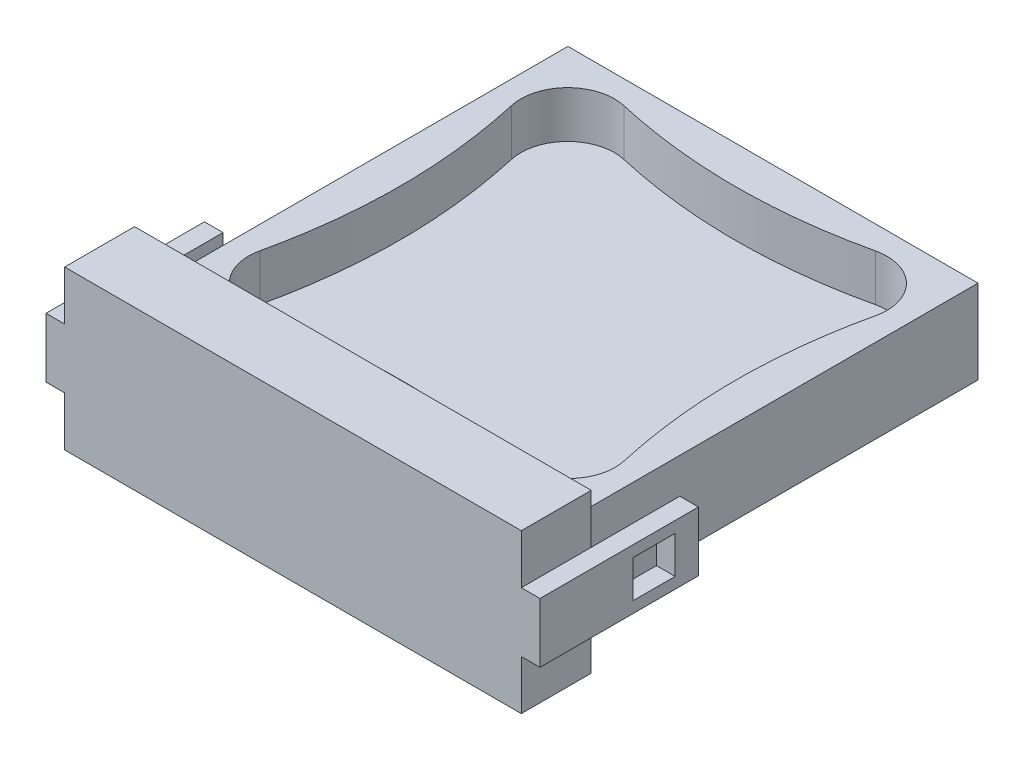
from build123d import *

# Parameters (mm, degrees)
SKETCH1_W           = 44
SKETCH1_H           = 44
BOSS_EXTRUDE1_DEPTH = 9
SKETCH2_W           = 49
SKETCH2_H           = 17
BOSS_EXTRUDE2_DEPTH = 7.5
CUT_EXTRUDE1_DEPTH  = 5
SKETCH4_W           = 4.5
SKETCH4_H           = 4
BOSS_EXTRUDE3_DEPTH = 2


with BuildPart() as part:
    # Sketch1 → Boss-Extrude1 (new body)
    with BuildSketch(Plane(origin=(0, 0, 0), x_dir=(1, 0, 0), z_dir=(0, 1, 0))):
        Rectangle(SKETCH1_W, SKETCH1_H)
    extrude(amount=BOSS_EXTRUDE1_DEPTH)

    # Sketch2 → Boss-Extrude2 (add)
    with BuildSketch(Plane.XY.offset(22)):
        with Locations((0, 4.5)):
            Rectangle(SKETCH2_W, SKETCH2_H)
    extrude(amount=BOSS_EXTRUDE2_DEPTH)

    # Sketch3 → Cut-Extrude1 (cut)
    with BuildSketch(Plane(origin=(0, 9, 0), x_dir=(1, 0, 0), z_dir=(0, 1, 0))):
        with BuildLine():
            ThreePointArc((-19.5325, -13.495), (-18.170661955, -18.166166123), (-13.49, -19.495))
            add(Edge.make_bspline(
                [(-13.49, -19.495), (-4.496666667, -17.441666667), (4.496666667, -17.441666667), (13.49, -19.495)],
                knots=[0, 0, 0, 0, 1, 1, 1, 1], degree=3))
            ThreePointArc((13.49, -19.495), (18.162524477, -18.157971004), (19.5325, -13.495))
            add(Edge.make_bspline(
                [(19.5325, 13.495), (16.4925, 0), (19.5325, -13.495)],
                knots=[0, 0, 0, 1, 1, 1], degree=2))
            ThreePointArc((19.5325, 13.495), (18.162524477, 18.157971004), (13.49, 19.495))
            add(Edge.make_bspline(
                [(-13.49, 19.495), (-4.496666667, 17.441666667), (4.496666667, 17.441666667), (13.49, 19.495)],
                knots=[0, 0, 0, 0, 1, 1, 1, 1], degree=3))
            ThreePointArc((-13.49, 19.495), (-18.170661955, 18.166166123), (-19.5325, 13.495))
            add(Edge.make_bspline(
                [(-19.5325, 13.495), (-18.519166667, 8.996666667), (-17.505833333, 0), (-18.519166667, -8.996666667), (-19.5325, -13.495)],
                knots=[0, 0, 0, 0, 0.5, 1, 1, 1, 1], degree=3))
        make_face()
    extrude(amount=-CUT_EXTRUDE1_DEPTH, mode=Mode.SUBTRACT)

    # Sketch4 → Boss-Extrude3 (add)
    with BuildSketch(Plane(origin=(24.5, 0, 0), x_dir=(0, 0, -1), z_dir=(1, 0, 0))):
        Polygon((-29.5, 4.5), (-29.5, 7.7), (-12.5, 7.7), (-12.5, 1.3), (-29.5, 1.3), align=None)
        with Locations((-17.25, 4.5)):
            Rectangle(SKETCH4_W, SKETCH4_H, mode=Mode.SUBTRACT)
    boss_extrude3 = extrude(amount=BOSS_EXTRUDE3_DEPTH)

    # Mirror1: Boss-Extrude3 across plane
    add(boss_extrude3.mirror(Plane(origin=(0, 0, 0), x_dir=(0, 0, 1), z_dir=(1, 0, 0))))


solid = part.part
